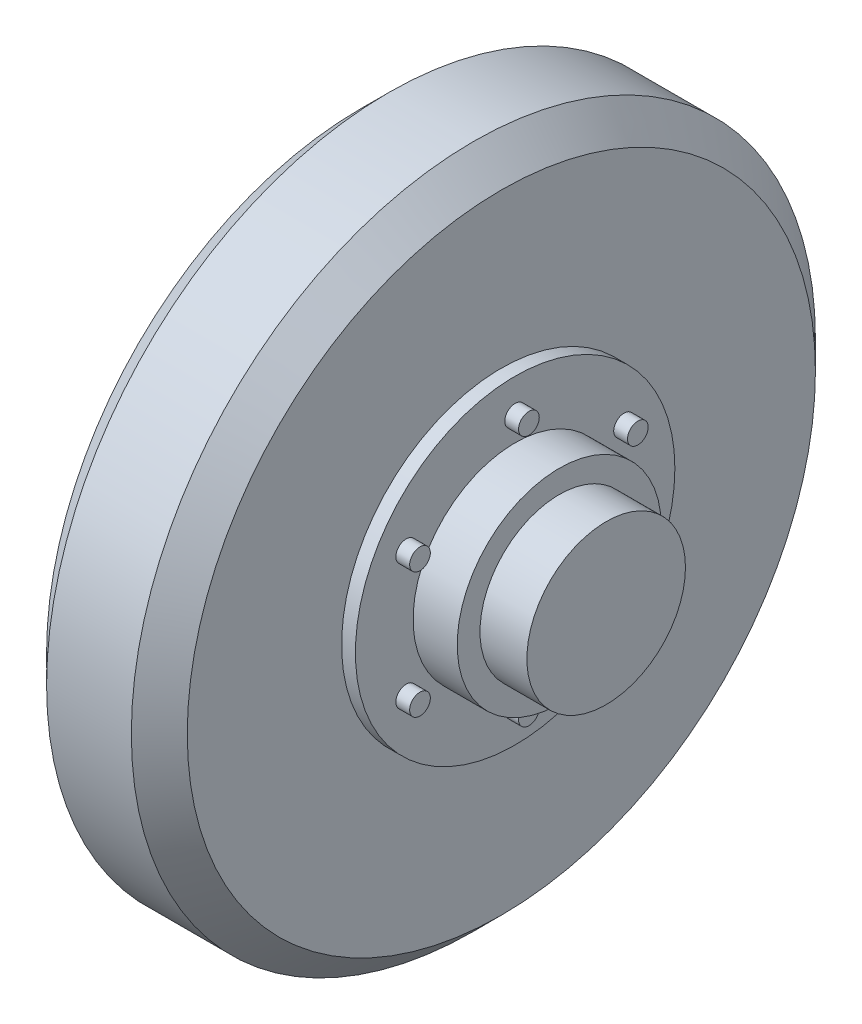
from build123d import *

# Parameters (mm, degrees)
SKETCH1_W           = 12.7
SKETCH1_H           = 14.9987
SKETCH1_W_2         = 21.59
SKETCH1_H_2         = 36.5125
SKETCH3_R           = 3.3734375
CUT_EXTRUDE1_DEPTH  = 11.43
SKETCH5_R           = 4.7625
BOSS_EXTRUDE1_DEPTH = 6.35


with BuildPart() as part:
    # Sketch1 → Revolve1 (revolve)
    with BuildSketch(Plane(origin=(0, 0, 0), x_dir=(-1, 0, 0), z_dir=(0, 1, 0)), mode=Mode.PRIVATE) as revolve1_sk:
        Polygon((0, 0), (0, 46.99), (-20.32, 46.99), (-20.32, 36.5125), (-20.32, 0), align=None)
        Polygon((6.35, 73.550123262), (0, 73.550123262), (0, 46.99), (0, 0), (71.12, 0), (71.12, 14.9987), (71.12, 144.605660924), (58.245660924, 157.48), (19.224339076, 157.48), (6.35, 144.605660924), align=None)
        with Locations((77.47, 7.49935)):
            Rectangle(SKETCH1_W, SKETCH1_H)
        Polygon((83.82, 14.9987), (83.82, 0), (90.17, 0), (90.17, 24.13), (83.82, 24.13), align=None)
        with Locations((-31.115, 18.25625)):
            Rectangle(SKETCH1_W_2, SKETCH1_H_2)
    revolve(revolve1_sk.sketch.rotate(Axis((0, 0, 0), (-1, 0, 0)), 180), axis=Axis((0, 0, 0), (-1, 0, 0)))

    # Sketch3 → Cut-Extrude1 (cut)
    with BuildSketch(Plane(origin=(-71.12, 0, 0), x_dir=(0, -1, 0), z_dir=(-1, 0, 0))):
        with Locations(Location((-22.394618112, 30.823547486, 0), (0, 0, 90))):
            Circle(SKETCH3_R)
        with Locations(Location((22.394618112, 30.823547486, 0), (0, 0, 90))):
            Circle(SKETCH3_R)
        with Locations(Location((36.235253271, -11.773547486, 0), (0, 0, 90))):
            Circle(SKETCH3_R)
        with Locations(Location((0, -38.1, 0), (0, 0, 90))):
            Circle(SKETCH3_R)
        with Locations(Location((-36.235253271, -11.773547486, 0), (0, 0, 90))):
            Circle(SKETCH3_R)
    extrude(amount=-CUT_EXTRUDE1_DEPTH, mode=Mode.SUBTRACT)

    # Sketch5 → Boss-Extrude1 (add)
    with BuildSketch(Plane.YZ):
        with Locations(Location((28.956, 50.153263184, 0), (0, 0, 270))):
            Circle(SKETCH5_R)
        with Locations(Location((-28.956, 50.153263184, 0), (0, 0, 270))):
            Circle(SKETCH5_R)
        with Locations(Location((-57.912, 0, 0), (0, 0, 270))):
            Circle(SKETCH5_R)
        with Locations(Location((-28.956, -50.153263184, 0), (0, 0, 270))):
            Circle(SKETCH5_R)
        with Locations(Location((28.956, -50.153263184, 0), (0, 0, 270))):
            Circle(SKETCH5_R)
        with Locations(Location((57.912, 0, 0), (0, 0, 270))):
            Circle(SKETCH5_R)
    extrude(amount=BOSS_EXTRUDE1_DEPTH)


solid = part.part
